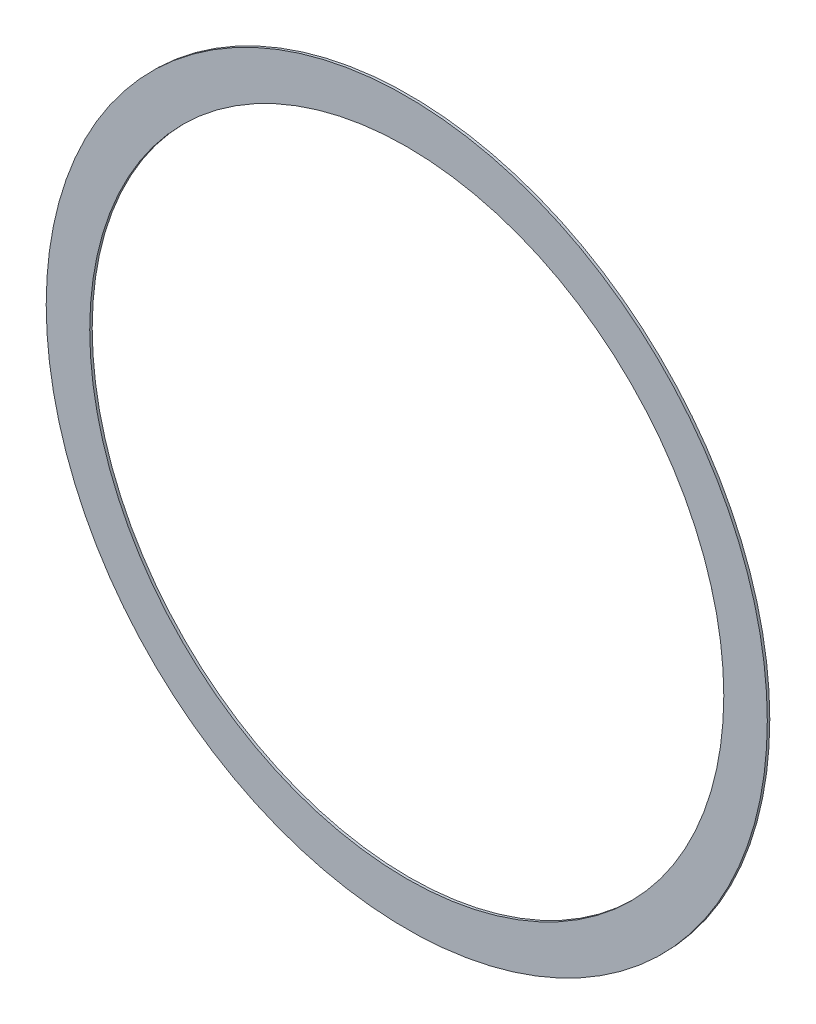
from build123d import *

# Parameters (mm, degrees)
SKETCH1_R           = 14.5
SKETCH1_R_2         = 12.75
BOSS_EXTRUDE1_DEPTH = 0.1


with BuildPart() as part:
    # Sketch1 → Boss-Extrude1 (new body)
    with BuildSketch(Plane.XY):
        Circle(SKETCH1_R)
        Circle(SKETCH1_R_2, mode=Mode.SUBTRACT)
    extrude(amount=BOSS_EXTRUDE1_DEPTH)


solid = part.part
